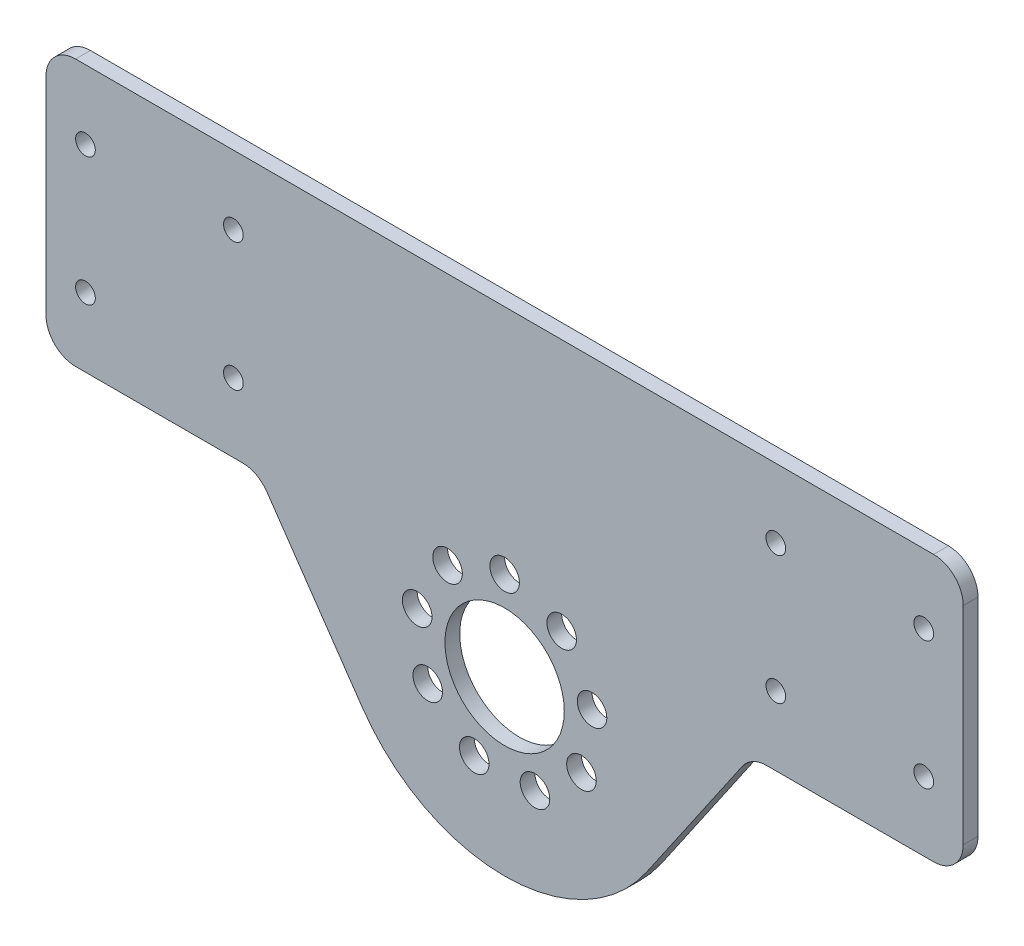
from build123d import *

# Parameters (mm, degrees)
ESQUISSE1_W             = 93
ESQUISSE1_H             = 27
ESQUISSE1_R             = 1
BOSS_EXTRU_1_DEPTH      = 1.5
BOSS_EXTRU_2_DEPTH      = 1.5
ESQUISSE3_R             = 6.05
ESQUISSE3_R_2           = 1.5
ENL_V_MAT_EXTRU_1_DEPTH = 69.297144889
CONG_2_R                = 3


with BuildPart() as part:
    # Esquisse1 → Boss.-Extru.1 (new body)
    with BuildSketch(Plane.XY):
        with Locations((0, -13.5)):
            Rectangle(ESQUISSE1_W, ESQUISSE1_H)
        with Locations((42.5, -7)):
            Circle(ESQUISSE1_R, mode=Mode.SUBTRACT)
        with Locations(Location((27.5, -7, 0), (0, 0, 180))):
            Circle(ESQUISSE1_R, mode=Mode.SUBTRACT)
        with Locations(Location((42.5, -20, 0), (0, 0, 180))):
            Circle(ESQUISSE1_R, mode=Mode.SUBTRACT)
        with Locations((27.5, -20)):
            Circle(ESQUISSE1_R, mode=Mode.SUBTRACT)
        with Locations(Location((-42.5, -7, 0), (0, 0, 180))):
            Circle(ESQUISSE1_R, mode=Mode.SUBTRACT)
        with Locations((-42.5, -20)):
            Circle(ESQUISSE1_R, mode=Mode.SUBTRACT)
        with Locations(Location((-27.5, -20, 0), (0, 0, 180))):
            Circle(ESQUISSE1_R, mode=Mode.SUBTRACT)
        with Locations((-27.5, -7)):
            Circle(ESQUISSE1_R, mode=Mode.SUBTRACT)
    extrude(amount=BOSS_EXTRU_1_DEPTH)

    # Esquisse2 → Boss.-Extru.2 (add)
    with BuildSketch(Plane.XY.offset(1.5)):
        with BuildLine():
            Line((-14.428612572, -42.402784419), (-25, -27))
            Line((-25, -27), (25, -27))
            Line((25, -27), (14.428612572, -42.402784419))
            ThreePointArc((14.428612572, -42.402784419), (0, -50), (-14.428612572, -42.402784419))
        make_face()
    extrude(amount=-BOSS_EXTRU_2_DEPTH)

    # Esquisse3 → Enlèv. mat.-Extru.1 (cut, through all)
    with BuildSketch(Plane.XY.offset(1.5)):
        with Locations((0, -32.5)):
            Circle(ESQUISSE3_R)
        with Locations((0, -23.5)):
            Circle(ESQUISSE3_R_2)
        with Locations((5.785088487, -25.605600012)):
            Circle(ESQUISSE3_R_2)
        with Locations((8.863269777, -30.937166401)):
            Circle(ESQUISSE3_R_2)
        with Locations((7.794228634, -37)):
            Circle(ESQUISSE3_R_2)
        with Locations((3.07818129, -40.957233587)):
            Circle(ESQUISSE3_R_2)
        with Locations((-3.07818129, -40.957233587)):
            Circle(ESQUISSE3_R_2)
        with Locations((-7.794228634, -37)):
            Circle(ESQUISSE3_R_2)
        with Locations((-8.863269777, -30.937166401)):
            Circle(ESQUISSE3_R_2)
        with Locations((-5.785088487, -25.605600012)):
            Circle(ESQUISSE3_R_2)
    extrude(amount=-ENL_V_MAT_EXTRU_1_DEPTH, mode=Mode.SUBTRACT)

    # Congé2
    cong_2_edges = [part.edges().sort_by_distance(p)[0] for p in [
        (46.5, 0, 0.75),
        (46.5, -27, 0.75),
        (-46.5, -27, 0.75),
        (-46.5, 0, 0.75),
        (25, -27, 0.75),
        (-25, -27, 0.75),
    ]]
    fillet(cong_2_edges, radius=CONG_2_R)


solid = part.part
